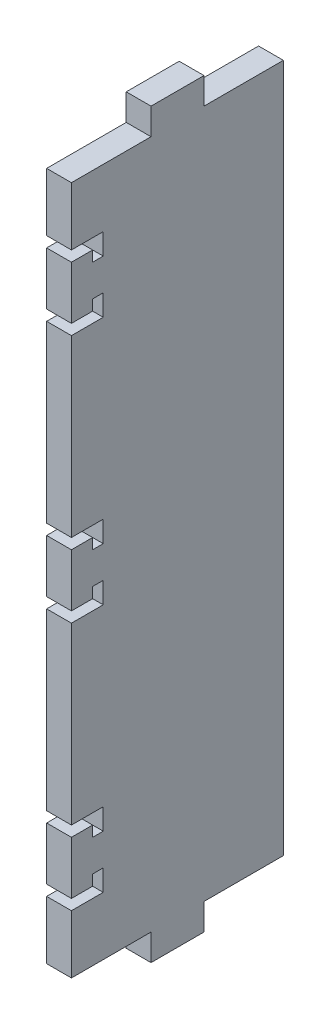
from build123d import *

# Parameters (mm, degrees)
BOSS_EXTRUDE1_DEPTH = 2.9718
CUT_EXTRUDE1_DEPTH  = 83.929967317


with BuildPart() as part:
    # Sketch1 → Boss-Extrude1 (new body)
    with BuildSketch(Plane.YZ):
        Polygon((-10.081561306, 16.077656644), (-6.906561306, 16.077656644), (-6.906561306, 25.616432341), (75.643438694, 25.616432341), (75.643438694, 16.077656644), (78.818438694, 16.077656644), (78.818438694, 9.72759764), (75.643438694, 9.72759764), (75.643438694, 0.216196324), (-6.906561306, 0.216196324), (-6.906561306, 9.72759764), (-10.081561306, 9.72759764), align=None)
    extrude(amount=BOSS_EXTRUDE1_DEPTH)

    # Sketch2 → Cut-Extrude1 (cut, through all)
    with BuildSketch(Plane.YZ.offset(2.9718)):
        Polygon((0.078438694, 25.616432341), (1.348438694, 25.616432341), (1.348438694, 23.076432341), (2.618438694, 23.076432341), (2.618438694, 21.806432341), (0.078438694, 21.806432341), align=None)
        Polygon((6.428438694, 23.076432341), (6.428438694, 21.806432341), (8.968438694, 21.806432341), (8.968438694, 25.616432341), (7.698438694, 25.616432341), (7.698438694, 23.076432341), align=None)
        Polygon((29.923438694, 25.616432341), (31.193438694, 25.616432341), (31.193438694, 23.076432341), (32.463438694, 23.076432341), (32.463438694, 21.806432341), (29.923438694, 21.806432341), align=None)
        Polygon((36.273438694, 23.076432341), (36.273438694, 21.806432341), (38.813438694, 21.806432341), (38.813438694, 25.616432341), (37.543438694, 25.616432341), (37.543438694, 23.076432341), align=None)
        Polygon((59.768438694, 25.616432341), (61.038438694, 25.616432341), (61.038438694, 23.076432341), (62.308438694, 23.076432341), (62.308438694, 21.806432341), (59.768438694, 21.806432341), align=None)
        Polygon((66.118438694, 23.076432341), (66.118438694, 21.806432341), (68.658438694, 21.806432341), (68.658438694, 25.616432341), (67.388438694, 25.616432341), (67.388438694, 23.076432341), align=None)
    extrude(amount=-CUT_EXTRUDE1_DEPTH, mode=Mode.SUBTRACT)


solid = part.part
